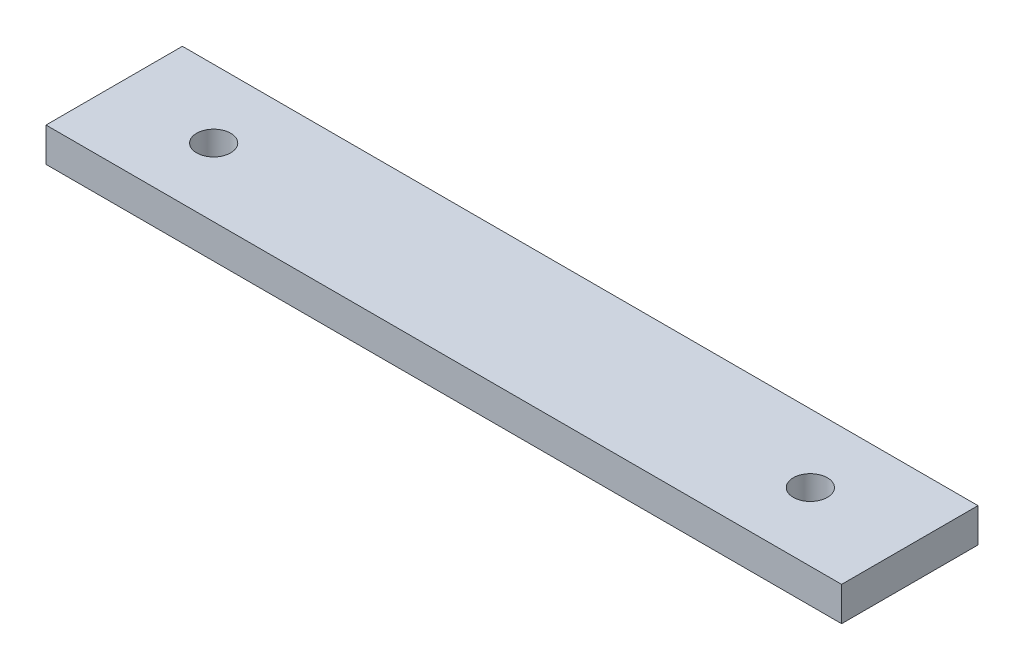
from build123d import *

# Parameters (mm, degrees)
SKETCH1_W           = 70
SKETCH1_H           = 12
BOSS_EXTRUDE1_DEPTH = 3
SKETCH3_R           = 1.5
CUT_EXTRUDE1_DEPTH  = 36.637059362


with BuildPart() as part:
    # Sketch1 → Boss-Extrude1 (new body)
    with BuildSketch(Plane(origin=(0, 0, 0), x_dir=(1, 0, 0), z_dir=(0, 1, 0))):
        Rectangle(SKETCH1_W, SKETCH1_H)
    extrude(amount=BOSS_EXTRUDE1_DEPTH)

    # Sketch3 → Cut-Extrude1 (cut, through all)
    with BuildSketch(Plane(origin=(0, 3, 0), x_dir=(1, 0, 0), z_dir=(0, 1, 0))):
        with Locations(Location((-26.25, 0, 0), (0, 0, 270))):
            Circle(SKETCH3_R)
        with Locations(Location((26.25, 0, 0), (0, 0, 270))):
            Circle(SKETCH3_R)
    extrude(amount=-CUT_EXTRUDE1_DEPTH, mode=Mode.SUBTRACT)


solid = part.part
